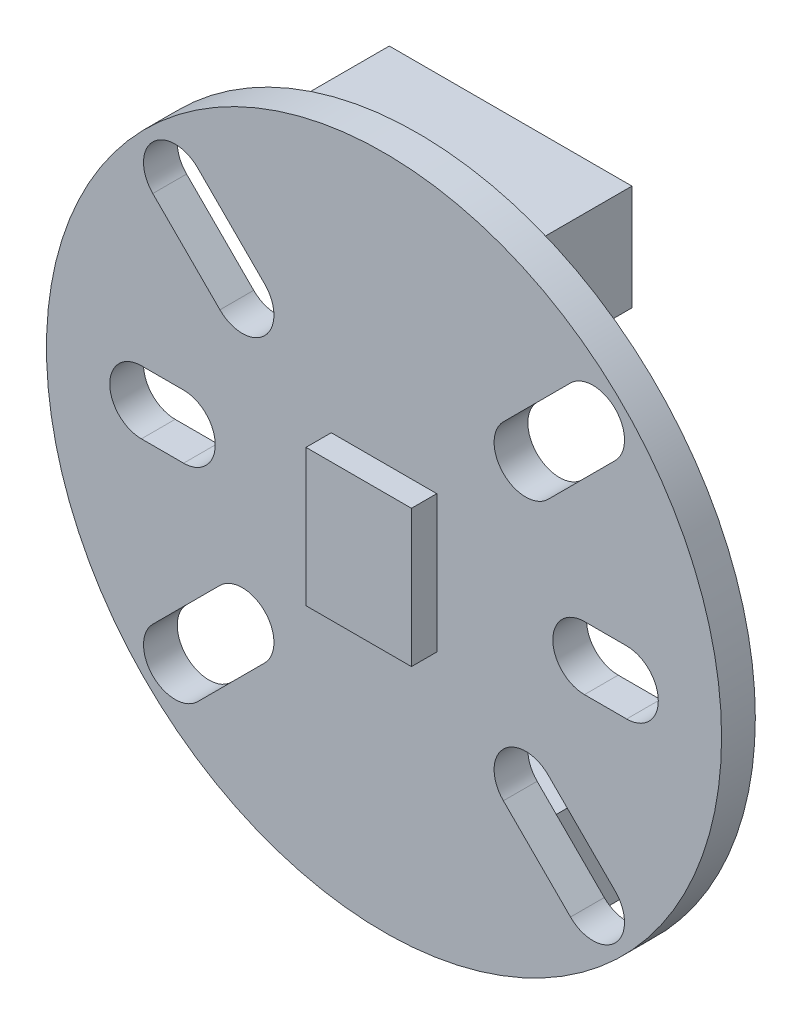
from build123d import *

# Parameters (mm, degrees)
SKETCH1_R           = 16
BOSS_EXTRUDE1_DEPTH = 1.6
SKETCH2_W           = 5
SKETCH2_H           = 6.5
BOSS_EXTRUDE2_DEPTH = 1.2
CUT_EXTRUDE1_DEPTH  = 23.683915006
SKETCH4_W           = 11.5
SKETCH4_H           = 5
BOSS_EXTRUDE3_DEPTH = 4.4


with BuildPart() as part:
    # Sketch1 → Boss-Extrude1 (new body)
    with BuildSketch(Plane.XY):
        Circle(SKETCH1_R)
    extrude(amount=BOSS_EXTRUDE1_DEPTH)

    # Sketch2 → Boss-Extrude2 (add)
    with BuildSketch(Plane.XY.offset(1.6)):
        Rectangle(SKETCH2_W, SKETCH2_H)
    extrude(amount=BOSS_EXTRUDE2_DEPTH)

    # Sketch3 → Cut-Extrude1 (cut, through all)
    with BuildSketch(Plane.XY.offset(1.6)):
        with BuildLine():
            Line((-5.656854249, -7.778174593), (-8.838834765, -10.960155108))
            ThreePointArc((-8.838834765, -10.960155108), (-10.960155108, -10.960155108), (-10.960155108, -8.838834765))
            Line((-10.960155108, -8.838834765), (-7.778174593, -5.656854249))
            ThreePointArc((-7.778174593, -5.656854249), (-5.656854249, -5.656854249), (-5.656854249, -7.778174593))
        make_face()
        with BuildLine():
            Line((-9.5, -1.5), (-11.5, -1.5))
            ThreePointArc((-11.5, -1.5), (-13, 0), (-11.5, 1.5))
            Line((-11.5, 1.5), (-9.5, 1.5))
            ThreePointArc((-9.5, 1.5), (-8, 0), (-9.5, -1.5))
        make_face()
        with BuildLine():
            Line((-7.778174593, 5.656854249), (-10.960155108, 8.838834765))
            ThreePointArc((-10.960155108, 8.838834765), (-10.960155108, 10.960155108), (-8.838834765, 10.960155108))
            Line((-8.838834765, 10.960155108), (-5.656854249, 7.778174593))
            ThreePointArc((-5.656854249, 7.778174593), (-5.656854249, 5.656854249), (-7.778174593, 5.656854249))
        make_face()
        with BuildLine():
            Line((5.656854249, 7.778174593), (8.838834765, 10.960155108))
            ThreePointArc((8.838834765, 10.960155108), (10.960155108, 10.960155108), (10.960155108, 8.838834765))
            Line((10.960155108, 8.838834765), (7.778174593, 5.656854249))
            ThreePointArc((7.778174593, 5.656854249), (5.656854249, 5.656854249), (5.656854249, 7.778174593))
        make_face()
        with BuildLine():
            Line((7.778174593, -5.656854249), (10.960155108, -8.838834765))
            ThreePointArc((10.960155108, -8.838834765), (10.960155108, -10.960155108), (8.838834765, -10.960155108))
            Line((8.838834765, -10.960155108), (5.656854249, -7.778174593))
            ThreePointArc((5.656854249, -7.778174593), (5.656854249, -5.656854249), (7.778174593, -5.656854249))
        make_face()
        with BuildLine():
            Line((9.5, 1.5), (11.5, 1.5))
            ThreePointArc((11.5, 1.5), (13, 0), (11.5, -1.5))
            Line((11.5, -1.5), (9.5, -1.5))
            ThreePointArc((9.5, -1.5), (8, 0), (9.5, 1.5))
        make_face()
    extrude(amount=-CUT_EXTRUDE1_DEPTH, mode=Mode.SUBTRACT)

    # Sketch4 → Boss-Extrude3 (add)
    with BuildSketch(Plane(origin=(0, 0, 0), x_dir=(-1, 0, 0), z_dir=(0, 0, -1))):
        with Locations((0, 12)):
            Rectangle(SKETCH4_W, SKETCH4_H)
        with Locations((0, -12)):
            Rectangle(SKETCH4_W, SKETCH4_H)
    extrude(amount=BOSS_EXTRUDE3_DEPTH)


solid = part.part
